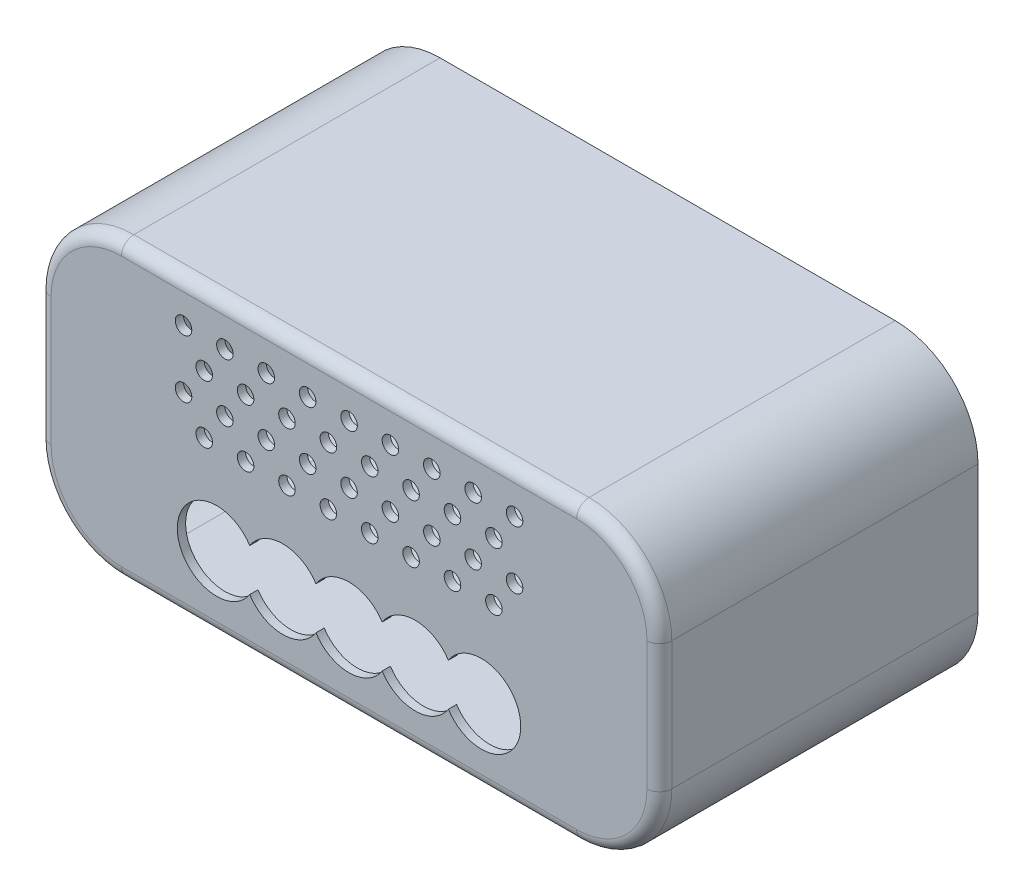
from build123d import *

# Parameters (mm, degrees)
SKETCH3_R           = 2
BOSS_EXTRUDE1_DEPTH = 2
BOSS_EXTRUDE2_DEPTH = 75
FILLET1_R           = 3


with BuildPart() as part:
    # Sketch3 → Boss-Extrude1 (new body)
    with BuildSketch(Plane.XY.offset(-3)):
        with BuildLine():
            Line((62.5, -66), (-47.5, -66))
            ThreePointArc((-47.5, -66), (-61.642135624, -60.142135624), (-67.5, -46))
            Line((-67.5, -46), (-67.5, -15))
            ThreePointArc((-67.5, -15), (-61.642135624, -0.857864376), (-47.5, 5))
            Line((-47.5, 5), (62.5, 5))
            ThreePointArc((62.5, 5), (76.642135624, -0.857864376), (82.5, -15))
            Line((82.5, -15), (82.5, -46))
            ThreePointArc((82.5, -46), (76.642135624, -60.142135624), (62.5, -66))
        make_face()
        with Locations((2.5, -12)):
            Circle(SKETCH3_R, mode=Mode.SUBTRACT)
        with Locations((12.5, -12)):
            Circle(SKETCH3_R, mode=Mode.SUBTRACT)
        with Locations((22.5, -12)):
            Circle(SKETCH3_R, mode=Mode.SUBTRACT)
        with Locations((32.5, -12)):
            Circle(SKETCH3_R, mode=Mode.SUBTRACT)
        with Locations((42.5, -12)):
            Circle(SKETCH3_R, mode=Mode.SUBTRACT)
        with Locations((-7.5, -12)):
            Circle(SKETCH3_R, mode=Mode.SUBTRACT)
        with Locations((-17.5, -12)):
            Circle(SKETCH3_R, mode=Mode.SUBTRACT)
        with Locations((-27.5, -12)):
            Circle(SKETCH3_R, mode=Mode.SUBTRACT)
        with Locations((7.5, -5)):
            Circle(SKETCH3_R, mode=Mode.SUBTRACT)
        with Locations((17.5, -5)):
            Circle(SKETCH3_R, mode=Mode.SUBTRACT)
        with Locations((27.5, -5)):
            Circle(SKETCH3_R, mode=Mode.SUBTRACT)
        with Locations((37.5, -5)):
            Circle(SKETCH3_R, mode=Mode.SUBTRACT)
        with Locations((47.5, -5)):
            Circle(SKETCH3_R, mode=Mode.SUBTRACT)
        with Locations((-2.5, -5)):
            Circle(SKETCH3_R, mode=Mode.SUBTRACT)
        with Locations((-12.5, -5)):
            Circle(SKETCH3_R, mode=Mode.SUBTRACT)
        with Locations((-22.5, -5)):
            Circle(SKETCH3_R, mode=Mode.SUBTRACT)
        with Locations((-32.5, -5)):
            Circle(SKETCH3_R, mode=Mode.SUBTRACT)
        with Locations((2.5, -26)):
            Circle(SKETCH3_R, mode=Mode.SUBTRACT)
        with Locations((12.5, -26)):
            Circle(SKETCH3_R, mode=Mode.SUBTRACT)
        with Locations((22.5, -26)):
            Circle(SKETCH3_R, mode=Mode.SUBTRACT)
        with Locations((32.5, -26)):
            Circle(SKETCH3_R, mode=Mode.SUBTRACT)
        with Locations((42.5, -26)):
            Circle(SKETCH3_R, mode=Mode.SUBTRACT)
        with Locations((-7.5, -26)):
            Circle(SKETCH3_R, mode=Mode.SUBTRACT)
        with Locations((-17.5, -26)):
            Circle(SKETCH3_R, mode=Mode.SUBTRACT)
        with Locations((-27.5, -26)):
            Circle(SKETCH3_R, mode=Mode.SUBTRACT)
        with Locations((7.5, -19)):
            Circle(SKETCH3_R, mode=Mode.SUBTRACT)
        with Locations((17.5, -19)):
            Circle(SKETCH3_R, mode=Mode.SUBTRACT)
        with Locations((27.5, -19)):
            Circle(SKETCH3_R, mode=Mode.SUBTRACT)
        with Locations((37.5, -19)):
            Circle(SKETCH3_R, mode=Mode.SUBTRACT)
        with Locations((47.5, -19)):
            Circle(SKETCH3_R, mode=Mode.SUBTRACT)
        with Locations((-2.5, -19)):
            Circle(SKETCH3_R, mode=Mode.SUBTRACT)
        with Locations((-12.5, -19)):
            Circle(SKETCH3_R, mode=Mode.SUBTRACT)
        with Locations((-22.5, -19)):
            Circle(SKETCH3_R, mode=Mode.SUBTRACT)
        with Locations((-32.5, -19)):
            Circle(SKETCH3_R, mode=Mode.SUBTRACT)
        with BuildLine():
            ThreePointArc((31.5, -53.323475383), (49, -48.2), (31.5, -43.076524617))
            ThreePointArc((31.5, -43.076524617), (23.5, -38.7), (15.5, -43.076524617))
            ThreePointArc((15.5, -43.076524617), (7.5, -38.7), (-0.5, -43.076524617))
            ThreePointArc((-0.5, -43.076524617), (-8.5, -38.7), (-16.5, -43.076524617))
            ThreePointArc((-16.5, -43.076524617), (-34, -48.2), (-16.5, -53.323475383))
            ThreePointArc((-16.5, -53.323475383), (-8.5, -57.7), (-0.5, -53.323475383))
            ThreePointArc((-0.5, -53.323475383), (7.5, -57.7), (15.5, -53.323475383))
            ThreePointArc((15.5, -53.323475383), (23.5, -57.7), (31.5, -53.323475383))
        make_face(mode=Mode.SUBTRACT)
    extrude(amount=-BOSS_EXTRUDE1_DEPTH)

    # Sketch5 → Boss-Extrude2 (add)
    with BuildSketch(Plane(origin=(0, 0, -5), x_dir=(-1, 0, 0), z_dir=(0, 0, -1))):
        with BuildLine():
            Line((67.5, -46), (67.5, -15))
            ThreePointArc((67.5, -15), (61.642135624, -0.857864376), (47.5, 5))
            Line((47.5, 5), (-62.5, 5))
            ThreePointArc((-62.5, 5), (-76.642135624, -0.857864376), (-82.5, -15))
            Line((-82.5, -15), (-82.5, -46))
            ThreePointArc((-82.5, -46), (-76.642135624, -60.142135624), (-62.5, -66))
            Line((-62.5, -66), (47.5, -66))
            ThreePointArc((47.5, -66), (61.642135624, -60.142135624), (67.5, -46))
        make_face()
        with BuildLine():
            Line((65.5, -46), (65.5, -15))
            ThreePointArc((65.5, -15), (60.227922061, -2.272077939), (47.5, 3))
            Line((47.5, 3), (-62.5, 3))
            ThreePointArc((-62.5, 3), (-75.227922061, -2.272077939), (-80.5, -15))
            Line((-80.5, -15), (-80.5, -46))
            ThreePointArc((-80.5, -46), (-75.227922061, -58.727922061), (-62.5, -64))
            Line((-62.5, -64), (47.5, -64))
            ThreePointArc((47.5, -64), (60.227922061, -58.727922061), (65.5, -46))
        make_face(mode=Mode.SUBTRACT)
    extrude(amount=BOSS_EXTRUDE2_DEPTH)

    # Fillet1
    fillet1_edges = [part.edges().sort_by_distance(p)[0] for p in [
        (82.5, -30.5, -3),
        (76.642135624, -60.142135624, -3),
        (7.5, -66, -3),
        (-61.642135624, -60.142135624, -3),
        (-60.227922061, -58.727922061, -5),
        (-65.5, -30.5, -5),
        (-60.227922061, -2.272077939, -5),
        (7.5, 3, -5),
        (75.227922061, -2.272077939, -5),
        (80.5, -30.5, -5),
        (75.227922061, -58.727922061, -5),
        (7.5, -64, -5),
        (-67.5, -30.5, -3),
        (-61.642135624, -0.857864376, -3),
        (7.5, 5, -3),
        (76.642135624, -0.857864376, -3),
    ]]
    fillet(fillet1_edges, radius=FILLET1_R)


solid = part.part
